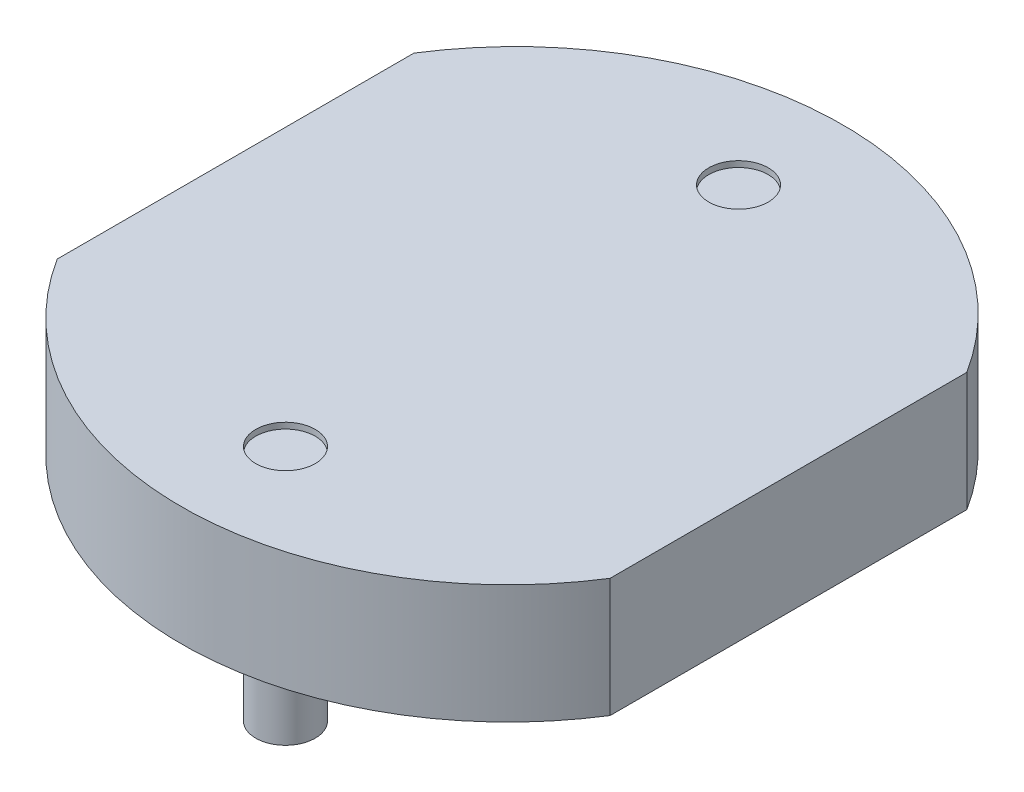
from build123d import *

# Parameters (mm, degrees)
BASE_EXTRUDE_DEPTH = 2
SKETCH2_R          = 0.5
PIN_EXTRUDE_DEPTH  = 2
SKETCH3_R          = 0.5
PIN_CUT_DEPTH      = 0.1


with BuildPart() as part:
    # Sketch1 → Base-Extrude (new body)
    with BuildSketch(Plane(origin=(0, 0, 0), x_dir=(1, 0, 0), z_dir=(0, 1, 0))):
        with BuildLine():
            Line((4.65, 3), (4.65, -3))
            ThreePointArc((4.65, -3), (0, -5.562739371), (-4.65, -3))
            Line((-4.65, -3), (-4.65, 3))
            ThreePointArc((-4.65, 3), (0, 5.562739371), (4.65, 3))
        make_face()
    extrude(amount=BASE_EXTRUDE_DEPTH)

    # Sketch2 → Pin-Extrude (add)
    with BuildSketch(Plane.XZ):
        with Locations(Location((0, 3.81, 0), (0, 0, 270))):
            Circle(SKETCH2_R)
        with Locations(Location((0, -3.81, 0), (0, 0, 90))):
            Circle(SKETCH2_R)
    extrude(amount=PIN_EXTRUDE_DEPTH)

    # Sketch3 → Pin-Cut (cut)
    with BuildSketch(Plane(origin=(0, 2, 0), x_dir=(1, 0, 0), z_dir=(0, 1, 0))):
        with Locations(Location((0, 3.81, 0), (0, 0, 270))):
            Circle(SKETCH3_R)
        with Locations(Location((0, -3.81, 0), (0, 0, 90))):
            Circle(SKETCH3_R)
    extrude(amount=-PIN_CUT_DEPTH, mode=Mode.SUBTRACT)


solid = part.part
